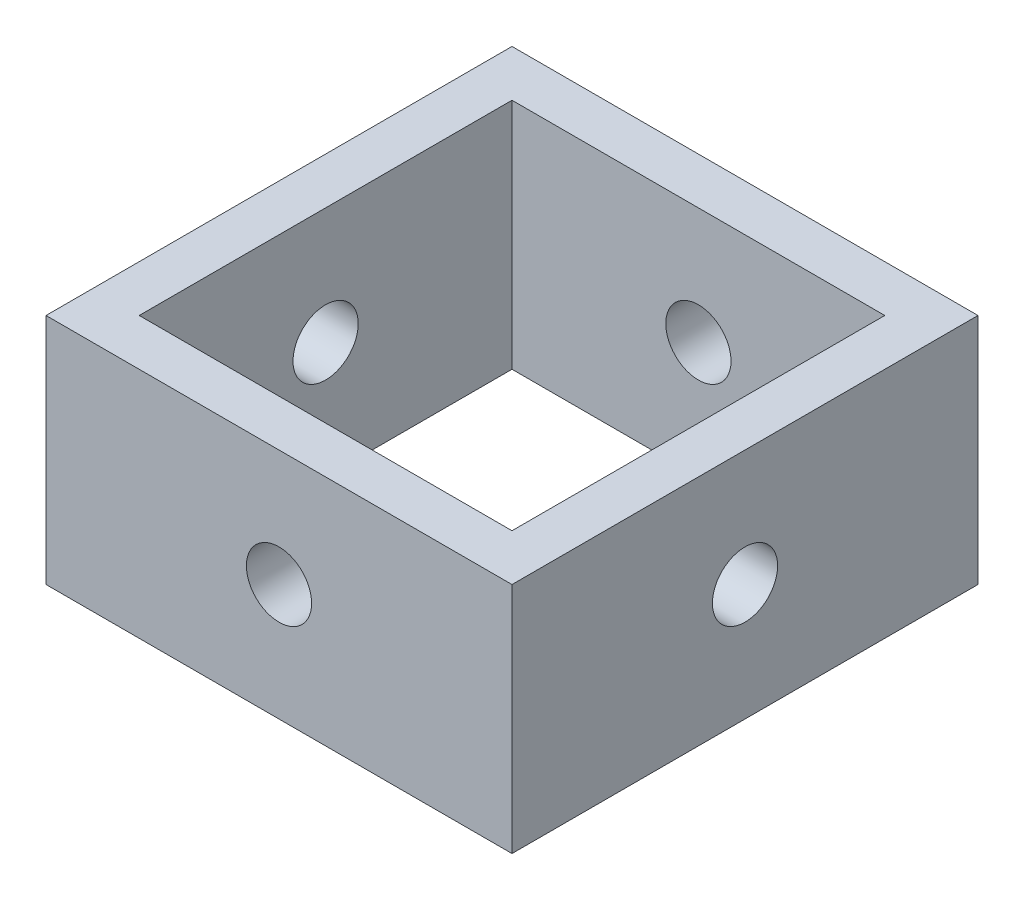
from build123d import *

# Parameters (mm, degrees)
SKETCH1_W           = 50
SKETCH1_H           = 50
SKETCH1_W_2         = 40
SKETCH1_H_2         = 40
BOSS_EXTRUDE1_DEPTH = 25
SKETCH2_R           = 3.5
CUT_EXTRUDE1_DEPTH  = 55
SKETCH3_R           = 3.5
CUT_EXTRUDE2_DEPTH  = 55


with BuildPart() as part:
    # Sketch1 → Boss-Extrude1 (new body)
    with BuildSketch(Plane(origin=(0, 0, 0), x_dir=(1, 0, 0), z_dir=(0, 1, 0))):
        Rectangle(SKETCH1_W, SKETCH1_H)
        Rectangle(SKETCH1_W_2, SKETCH1_H_2, mode=Mode.SUBTRACT)
    extrude(amount=BOSS_EXTRUDE1_DEPTH)

    # Sketch2 → Cut-Extrude1 (cut)
    with BuildSketch(Plane(origin=(25, 0, 0), x_dir=(0, 0, -1), z_dir=(1, 0, 0))):
        with Locations((0, 12.5)):
            Circle(SKETCH2_R)
    extrude(amount=-CUT_EXTRUDE1_DEPTH, mode=Mode.SUBTRACT)

    # Sketch3 → Cut-Extrude2 (cut)
    with BuildSketch(Plane.XY.offset(25)):
        with Locations((0, 12.5)):
            Circle(SKETCH3_R)
    extrude(amount=-CUT_EXTRUDE2_DEPTH, mode=Mode.SUBTRACT)


solid = part.part
